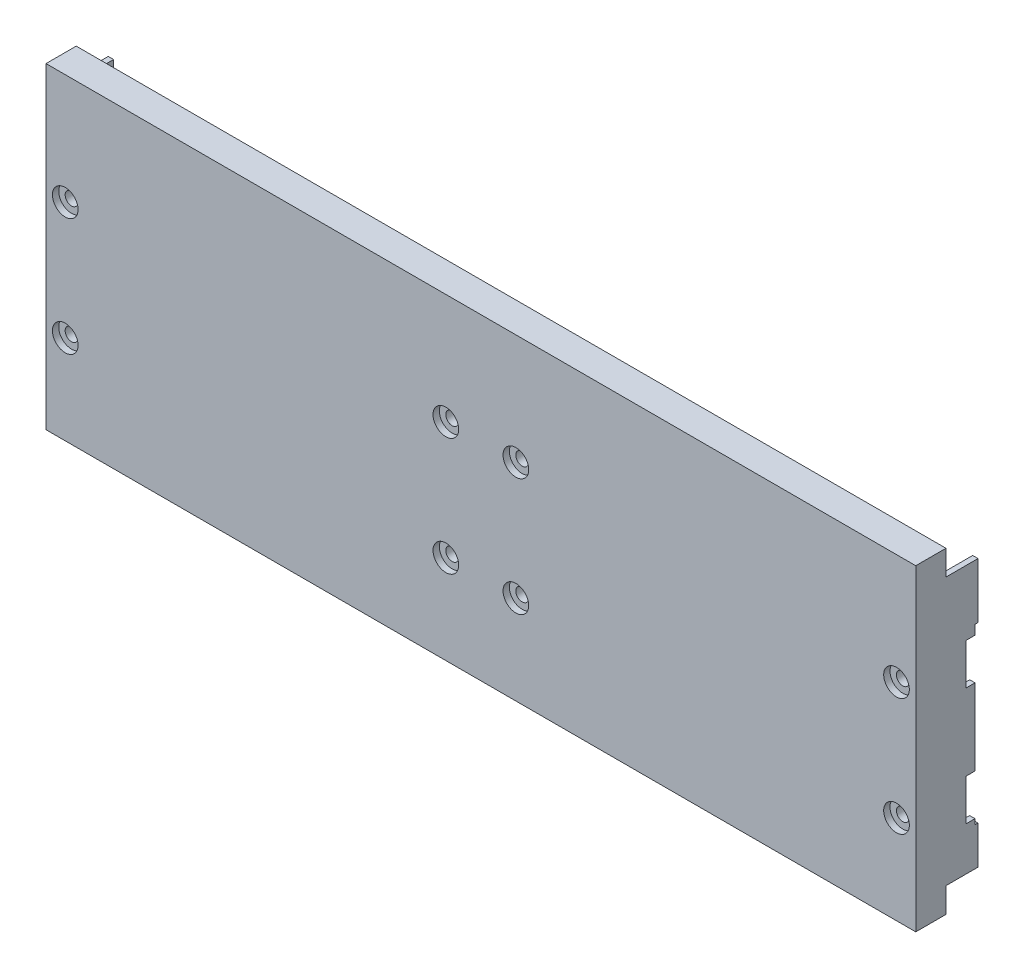
from build123d import *

# Parameters (mm, degrees)
SKETCH1_W                      = 206.629
SKETCH1_H                      = 63.5
BASE_DEPTH                     = 5.08
SKETCH2_W                      = 203.581
SKETCH2_H                      = 60.452
HOLLOW_DEPTH                   = 2.000000064
SKETCH3_W                      = 1.27
SKETCH3_H                      = 63.5
END_PIECES_DEPTH               = 9.000000034
SKETCH7_W                      = 2.201400112
SKETCH7_H                      = 9.798
WHERE_TOP_INTRUDES_DEPTH       = 210.769754403
CABLE_STOP_WINGS_ALT_W         = 206.629
CABLE_STOP_WINGS_ALT_H         = 5
CABLE_STOP_WING_BOSS_ALT_DEPTH = 1.500000048
SKETCH4_R                      = 3.175
SCREW_BOSSES_DEPTH             = 2.000000064
SKETCH5_R                      = 1.524
SCREW_HOLES_DEPTH              = 146.00946706
SKETCH6_R                      = 3.048
COUNTER_SINK_DEPTH             = 1.500000048
SKETCH25_W                     = 206.629
SKETCH25_H                     = 4.5
BOX_UNDER_CONNECTORS_DEPTH     = 7.1786
SKETCH26_W                     = 7.1786
SKETCH26_H                     = 75.34
FILL_ENDS_DEPTH                = 1.5
FILL_START                     = -206.629
SKETCH26_2_W                   = 7.1786
SKETCH26_2_H                   = 75.34
FILL_THE_OTHER_END_DEPTH       = 1.5
BOSS_EXTRUDE4_START            = -1.27
SKETCH27_W                     = 0.708599966
SKETCH27_H                     = 9.088
SKETCH27_H_2                   = 13.169
BOSS_EXTRUDE4_DEPTH            = 1.27
BOSS_EXTRUDE5_START            = -206.629
SKETCH27_2_W                   = 0.708599966
SKETCH27_2_H                   = 9.088
SKETCH27_2_H_2                 = 13.169
BOSS_EXTRUDE5_DEPTH            = 1.270001


with BuildPart() as part:
    # Sketch1 → base (new body)
    with BuildSketch(Plane.XY):
        with Locations((-35.77065873, 3.275793651)):
            Rectangle(SKETCH1_W, SKETCH1_H)
    extrude(amount=BASE_DEPTH)

    # Sketch2 → hollow (cut)
    with BuildSketch(Plane(origin=(0, 0, 0), x_dir=(-1, 0, 0), z_dir=(0, 0, -1))):
        with Locations((35.77065873, 3.275793651)):
            Rectangle(SKETCH2_W, SKETCH2_H)
    extrude(amount=-HOLLOW_DEPTH, mode=Mode.SUBTRACT)

    # Sketch3 → end pieces (add)
    with BuildSketch(Plane(origin=(0, 0, 0), x_dir=(-1, 0, 0), z_dir=(0, 0, -1))):
        with Locations((138.45015873, 3.275793651)):
            Rectangle(SKETCH3_W, SKETCH3_H)
        with Locations((-66.90884127, 3.275793651)):
            Rectangle(SKETCH3_W, SKETCH3_H)
    extrude(amount=END_PIECES_DEPTH)

    # Sketch7 → where top intrudes (cut, through all)
    with BuildSketch(Plane(origin=(67.54384127, 0, 0), x_dir=(0, 0, -1), z_dir=(1, 0, 0))):
        with Locations((7.899299978, 14.705793651)):
            Rectangle(SKETCH7_W, SKETCH7_H)
        with Locations((7.899299978, -13.234206349)):
            Rectangle(SKETCH7_W, SKETCH7_H)
    extrude(amount=-WHERE_TOP_INTRUDES_DEPTH, mode=Mode.SUBTRACT)

    # cable stop wings alt → cable stop wing boss alt (add)
    with BuildSketch(Plane.XY.offset(5.08)):
        with Locations((-35.77065873, -30.974206349)):
            Rectangle(CABLE_STOP_WINGS_ALT_W, CABLE_STOP_WINGS_ALT_H)
        with Locations((-35.77065873, 37.525793651)):
            Rectangle(CABLE_STOP_WINGS_ALT_W, CABLE_STOP_WINGS_ALT_H)
    extrude(amount=-CABLE_STOP_WING_BOSS_ALT_DEPTH)

    # Sketch4 → screw bosses (add)
    with BuildSketch(Plane(origin=(0, 0, 2.000000064), x_dir=(-1, 0, 0), z_dir=(0, 0, -1))):
        with Locations((-62.97184127, 14.705793651)):
            Circle(SKETCH4_R)
        with Locations((-62.97184127, -13.234206349)):
            Circle(SKETCH4_R)
        with Locations((27.45215873, -13.234206349)):
            Circle(SKETCH4_R)
        with Locations((44.08915873, -13.234206349)):
            Circle(SKETCH4_R)
        with Locations((27.45215873, 14.705793651)):
            Circle(SKETCH4_R)
        with Locations((44.08915873, 14.705793651)):
            Circle(SKETCH4_R)
        with Locations((134.51315873, 14.705793651)):
            Circle(SKETCH4_R)
        with Locations((134.51315873, -13.234206349)):
            Circle(SKETCH4_R)
    extrude(amount=SCREW_BOSSES_DEPTH)

    # Sketch5 → screw holes (cut, through all)
    with BuildSketch(Plane(origin=(0, 0, 0), x_dir=(-1, 0, 0), z_dir=(0, 0, -1))):
        with Locations((-62.97184127, 14.705793651)):
            Circle(SKETCH5_R)
        with Locations((-62.97184127, -13.234206349)):
            Circle(SKETCH5_R)
        with Locations((27.45215873, 14.705793651)):
            Circle(SKETCH5_R)
        with Locations((27.45215873, -13.234206349)):
            Circle(SKETCH5_R)
        with Locations((44.08915873, -13.234206349)):
            Circle(SKETCH5_R)
        with Locations((134.51315873, 14.705793651)):
            Circle(SKETCH5_R)
        with Locations((134.51315873, -13.234206349)):
            Circle(SKETCH5_R)
        with Locations((44.08915873, 14.705793651)):
            Circle(SKETCH5_R)
    extrude(amount=-SCREW_HOLES_DEPTH, mode=Mode.SUBTRACT)

    # Sketch6 → counter sink (cut)
    with BuildSketch(Plane.XY.offset(5.08)):
        with Locations((62.97184127, -13.234206349)):
            Circle(SKETCH6_R)
        with Locations((62.97184127, 14.705793651)):
            Circle(SKETCH6_R)
        with Locations((-27.45215873, -13.234206349)):
            Circle(SKETCH6_R)
        with Locations((-44.08915873, -13.234206349)):
            Circle(SKETCH6_R)
        with Locations((-27.45215873, 14.705793651)):
            Circle(SKETCH6_R)
        with Locations((-44.08915873, 14.705793651)):
            Circle(SKETCH6_R)
        with Locations((-134.51315873, 14.705793651)):
            Circle(SKETCH6_R)
        with Locations((-134.51315873, -13.234206349)):
            Circle(SKETCH6_R)
    extrude(amount=-COUNTER_SINK_DEPTH, mode=Mode.SUBTRACT)

    # Sketch25 → box under connectors (add)
    with BuildSketch(Plane.XY.offset(5.08)):
        with Locations((-35.77065873, 38.695793651)):
            Rectangle(SKETCH25_W, SKETCH25_H)
        with Locations((-35.77065873, -32.144206349)):
            Rectangle(SKETCH25_W, SKETCH25_H)
    extrude(amount=-BOX_UNDER_CONNECTORS_DEPTH)

    # Sketch26 → Fill ends (add)
    with BuildSketch(Plane.ZY.offset(139.08515873)):
        with Locations((1.4907, 3.275793651)):
            Rectangle(SKETCH26_W, SKETCH26_H)
    extrude(amount=-FILL_ENDS_DEPTH)

    # Sketch26<2> → Fill the other end (add)
    with BuildSketch(Plane.ZY.offset(139.08515873).offset(FILL_START)):
        with Locations((1.4907, 3.275793651)):
            Rectangle(SKETCH26_2_W, SKETCH26_2_H)
    extrude(amount=FILL_THE_OTHER_END_DEPTH)

    # Sketch27 → Boss-Extrude4 (add)
    with BuildSketch(Plane.ZY.offset(139.08515873).offset(BOSS_EXTRUDE4_START)):
        with Locations((-9.354300017, -23.930206349)):
            Rectangle(SKETCH27_W, SKETCH27_H)
        with Locations((-9.354300017, 28.441293651)):
            Rectangle(SKETCH27_W, SKETCH27_H_2)
    extrude(amount=BOSS_EXTRUDE4_DEPTH)

    # Sketch27<2> → Boss-Extrude5 (add)
    with BuildSketch(Plane.ZY.offset(139.08515873).offset(BOSS_EXTRUDE5_START)):
        with Locations((-9.354300017, -23.930206349)):
            Rectangle(SKETCH27_2_W, SKETCH27_2_H)
        with Locations((-9.354300017, 28.441293651)):
            Rectangle(SKETCH27_2_W, SKETCH27_2_H_2)
    extrude(amount=BOSS_EXTRUDE5_DEPTH)


solid = part.part
